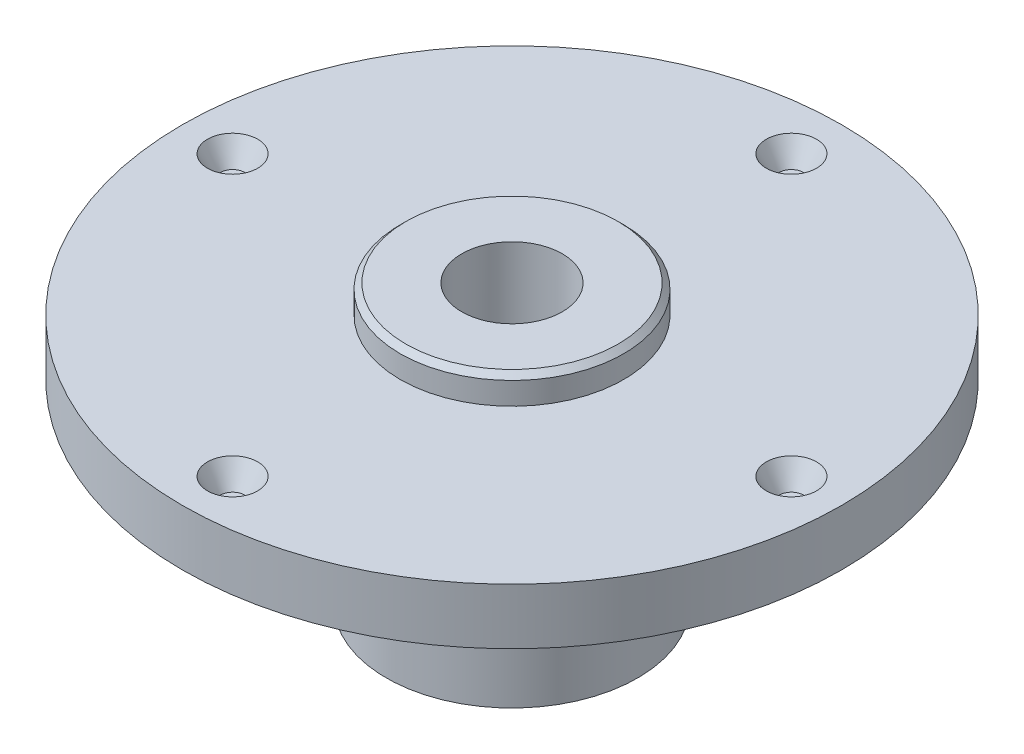
from build123d import *

# Parameters (mm, degrees)
R_P_TITION_CIRCULAIRE1_COUNT = 4
ESQUISSE3_R                  = 2.5
ENL_V_MAT_EXTRU_1_DEPTH      = 22.5
CHANFREIN1_SIZE              = 1


with BuildPart() as part:
    # Esquisse1 → Base-Révolution (revolve)
    with BuildSketch(Plane.XY, mode=Mode.PRIVATE) as base_r_volution_sk:
        Polygon((9, 0), (22.5, 0), (22.5, 35), (59, 35), (59, 45), (20, 45), (20, 50), (9, 50), align=None)
    revolve(base_r_volution_sk.sketch.rotate(Axis((0, 0, 0), (0, 1, 0)), 90), axis=Axis((0, 0, 0), (0, 1, 0)))

    # Esquisse2 → Enlever de la matière-Révolution1 (revolve, cut)
    with BuildSketch(Plane.XY, mode=Mode.PRIVATE) as enlever_de_la_mati_re_r_volution1_sk:
        Polygon((50, 45), (45.5, 45), (47.809401077, 41), (50, 41), align=None)
    enlever_de_la_mati_re_r_volution1 = revolve(enlever_de_la_mati_re_r_volution1_sk.sketch.rotate(Axis((50, 50.797703058, 0), (0, -1, 0)), 270), axis=Axis((50, 50.797703058, 0), (0, -1, 0)), mode=Mode.SUBTRACT)

    # Répétition circulaire1: Enlever de la matière-Révolution1 ×4 about axis
    r_p_tition_circulaire1_axis = Axis((0, 0, 0), (0, 1, 0))
    for i in range(1, R_P_TITION_CIRCULAIRE1_COUNT):
        add(enlever_de_la_mati_re_r_volution1.rotate(r_p_tition_circulaire1_axis, i * 360 / R_P_TITION_CIRCULAIRE1_COUNT), mode=Mode.SUBTRACT)

    # Esquisse3 → Enlèv. mat.-Extru.1 (cut, symmetric)
    with BuildSketch(Plane(origin=(0, 0, 0), x_dir=(0, 0, -1), z_dir=(1, 0, 0))):
        with Locations((0, 15)):
            Circle(ESQUISSE3_R)
    extrude(amount=ENL_V_MAT_EXTRU_1_DEPTH, both=True, mode=Mode.SUBTRACT)

    # Chanfrein1
    chanfrein1_edges = [part.edges().sort_by_distance(p)[0] for p in [
        (0, 50, 20),
    ]]
    chamfer(chanfrein1_edges, length=CHANFREIN1_SIZE)


solid = part.part
